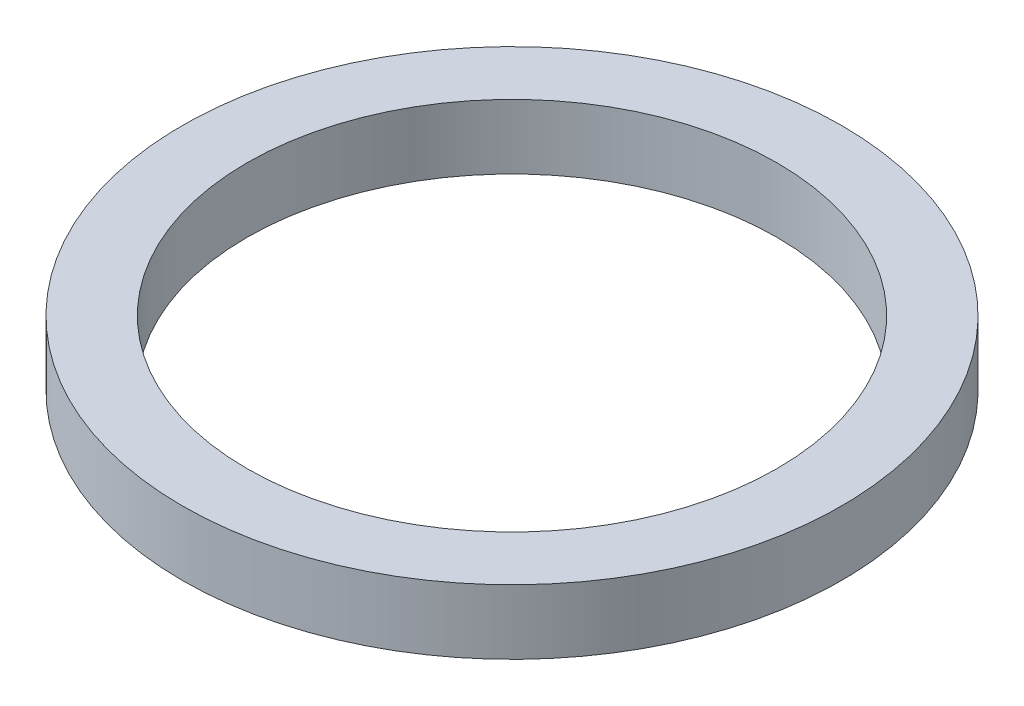
from build123d import *

# Parameters (mm, degrees)
SKETCH2_R           = 12.75
SKETCH2_R_2         = 10.25
BOSS_EXTRUDE1_DEPTH = 2.5


with BuildPart() as part:
    # Sketch2 → Boss-Extrude1 (new body)
    with BuildSketch(Plane(origin=(0, 0, 0), x_dir=(1, 0, 0), z_dir=(0, 1, 0))):
        with Locations(Location((0, 0, 0), (0, 0, 270))):
            Circle(SKETCH2_R)
        with Locations(Location((0, 0, 0), (0, 0, 270))):
            Circle(SKETCH2_R_2, mode=Mode.SUBTRACT)
    extrude(amount=BOSS_EXTRUDE1_DEPTH)


solid = part.part
